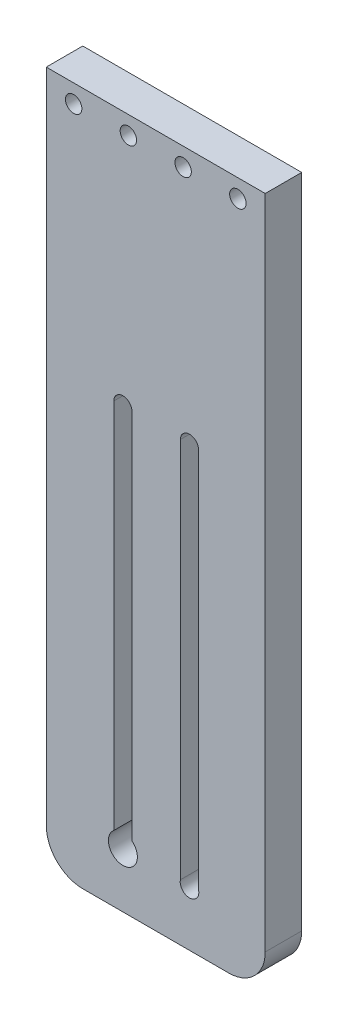
from build123d import *

# Parameters (mm, degrees)
EXTRUDE_1_DEPTH            = 10
HOLE_WIZARD_M4_D           = 4.5
HOLE_WIZARD_M4_CBORE_D     = 8
HOLE_WIZARD_M4_CBORE_DEPTH = 4
HOLE_WIZARD_1_4_201_D      = 5.1054
HOLE_WIZARD_3_8_161_D      = 7.9375
CUT_EXTRUDE_1_DEPTH        = 200.499373433
FILLET_1_R                 = 10
SKETCH_14_W                = 20.2
SKETCH_14_H                = 40
CUT_EXTRUDE_2_DEPTH        = 7
SKETCH_15_R                = 2
CUT_EXTRUDE_3_DEPTH        = 7
FILLET_2_R                 = 4


with BuildPart() as part:
    # Эскиз1 → Бобышка-Вытянуть1 (new body)
    with BuildSketch(Plane.XY):
        Polygon((0, 0), (60, 0), (60, -60), (60, -150), (60, -190), (0, -190), align=None)
    extrude(amount=EXTRUDE_1_DEPTH)

    # Цековка для винта с внутренним шестигранником M4 (through all)
    with Locations(Plane(origin=(-14.842707118, -41.655134189, 0), x_dir=(-1, 0, 0), z_dir=(0, 0, -1))):
        with Locations((-67.342707118, 36.655134189), (-52.342707118, 36.655134189), (-37.342707118, 36.655134189), (-22.342707118, 36.655134189)):
            CounterBoreHole(HOLE_WIZARD_M4_D / 2, HOLE_WIZARD_M4_CBORE_D / 2, HOLE_WIZARD_M4_CBORE_DEPTH)

    # Отверстие обработанное метчиком 1/4-201 (through all)
    with Locations(Plane(origin=(39.25, -175, 10), x_dir=(1, 0, 0), z_dir=(0, 0, 1))):
        with Locations((0, 0)):
            Hole(HOLE_WIZARD_1_4_201_D / 2)

    # Отверстие обработанное метчиком 3/8-161 (through all)
    with Locations(Plane(origin=(21, -175, 10), x_dir=(1, 0, 0), z_dir=(0, 0, 1))):
        with Locations((0, 0)):
            Hole(HOLE_WIZARD_3_8_161_D / 2)

    # Эскиз12 → Вырез-Вытянуть1 (cut, through all)
    with BuildSketch(Plane.XY.offset(10)):
        with BuildLine():
            Line((36.75, -175), (36.75, -70))
            ThreePointArc((36.75, -70), (39.25, -67.5), (41.75, -70))
            Line((41.75, -70), (41.75, -175))
            ThreePointArc((41.75, -175), (39.25, -177.5), (36.75, -175))
        make_face()
        with BuildLine():
            Line((18.5, -175), (18.5, -70))
            ThreePointArc((18.5, -70), (21, -67.5), (23.5, -70))
            Line((23.5, -70), (23.5, -175))
            ThreePointArc((23.5, -175), (21, -177.5), (18.5, -175))
        make_face()
    extrude(amount=-CUT_EXTRUDE_1_DEPTH, mode=Mode.SUBTRACT)

    # Скругление1
    fillet_1_edges = [part.edges().sort_by_distance(p)[0] for p in [
        (60, -190, 5),
        (0, -190, 5),
    ]]
    fillet(fillet_1_edges, radius=FILLET_1_R)

    # Эскиз14 → Вырез-Вытянуть2 (cut)
    with BuildSketch(Plane(origin=(0, 0, 0), x_dir=(-1, 0, 0), z_dir=(0, 0, -1))):
        with Locations((-30, -35)):
            Rectangle(SKETCH_14_W, SKETCH_14_H)
    extrude(amount=-CUT_EXTRUDE_2_DEPTH, mode=Mode.SUBTRACT)

    # Эскиз15 → Вырез-Вытянуть3 (cut)
    with BuildSketch(Plane(origin=(0, 0, 0), x_dir=(-1, 0, 0), z_dir=(0, 0, -1))):
        with Locations((-40.1, -55)):
            Circle(SKETCH_15_R)
        with Locations((-19.9, -55)):
            Circle(SKETCH_15_R)
    extrude(amount=-CUT_EXTRUDE_3_DEPTH, mode=Mode.SUBTRACT)

    # Скругление2
    fillet_2_edges = [part.edges().sort_by_distance(p)[0] for p in [
        (19.9, -15, 3.5),
        (40.1, -15, 3.5),
        (38.1, -55, 3.5),
        (40.1, -53, 3.5),
        (19.9, -53, 3.5),
        (21.9, -55, 3.5),
    ]]
    fillet(fillet_2_edges, radius=FILLET_2_R)


solid = part.part
